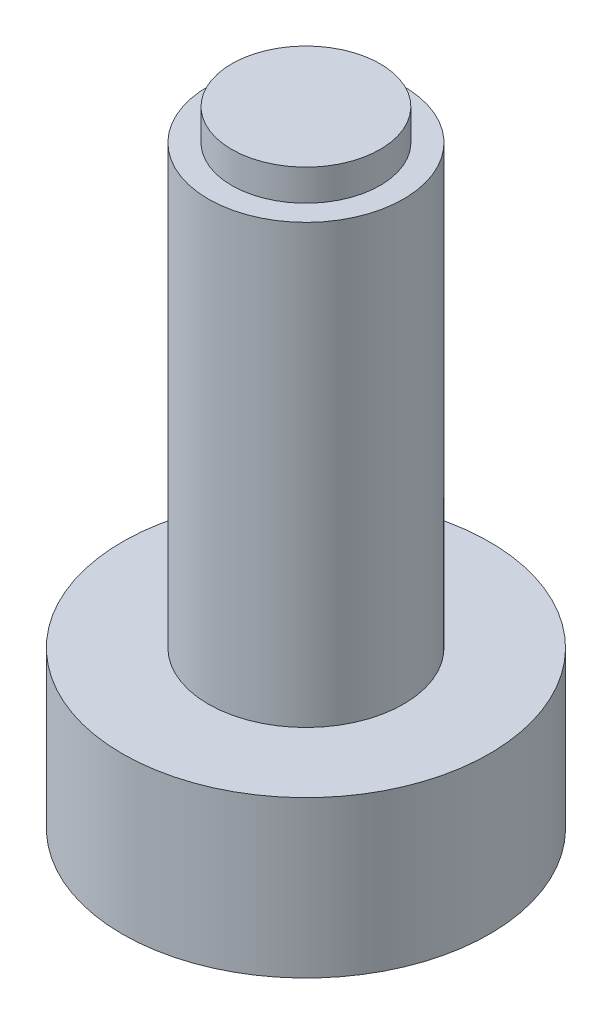
from build123d import *

# Parameters (mm, degrees)
SKETCH1_R           = 4.7
BOSS_EXTRUDE1_DEPTH = 2
SKETCH2_R           = 2.5
BOSS_EXTRUDE2_DEPTH = 5.6
SKETCH3_R           = 1.9
BOSS_EXTRUDE3_DEPTH = 0.4
CUT_EXTRUDE1_DEPTH  = 1.25


with BuildPart() as part:
    # Sketch1 → Boss-Extrude1 (new, symmetric)
    with BuildSketch(Plane(origin=(0, -2, 0), x_dir=(1, 0, 0), z_dir=(0, 1, 0))):
        with Locations(Location((0, 0, 0), (0, 0, 270))):
            Circle(SKETCH1_R)
    extrude(amount=BOSS_EXTRUDE1_DEPTH, both=True)

    # Sketch2 → Boss-Extrude2 (add, symmetric)
    with BuildSketch(Plane(origin=(0, 5.6, 0), x_dir=(1, 0, 0), z_dir=(0, 1, 0))):
        with Locations(Location((0, 0, 0), (0, 0, 270))):
            Circle(SKETCH2_R)
    extrude(amount=BOSS_EXTRUDE2_DEPTH, both=True)

    # Sketch3 → Boss-Extrude3 (add, symmetric)
    with BuildSketch(Plane(origin=(0, 11.6, 0), x_dir=(1, 0, 0), z_dir=(0, 1, 0))):
        with Locations(Location((0, 0, 0), (0, 0, 270))):
            Circle(SKETCH3_R)
    extrude(amount=BOSS_EXTRUDE3_DEPTH, both=True)

    # Sketch4 → Cut-Extrude1 (cut, symmetric)
    with BuildSketch(Plane(origin=(0, -2.75, 0), x_dir=(1, 0, 0), z_dir=(0, 1, 0))):
        Polygon((1.732050808, 0), (0.866025404, -1.5), (-0.866025404, -1.5), (-1.732050808, 0), (-0.866025404, 1.5), (0.866025404, 1.5), align=None)
    extrude(amount=CUT_EXTRUDE1_DEPTH, both=True, mode=Mode.SUBTRACT)


solid = part.part
